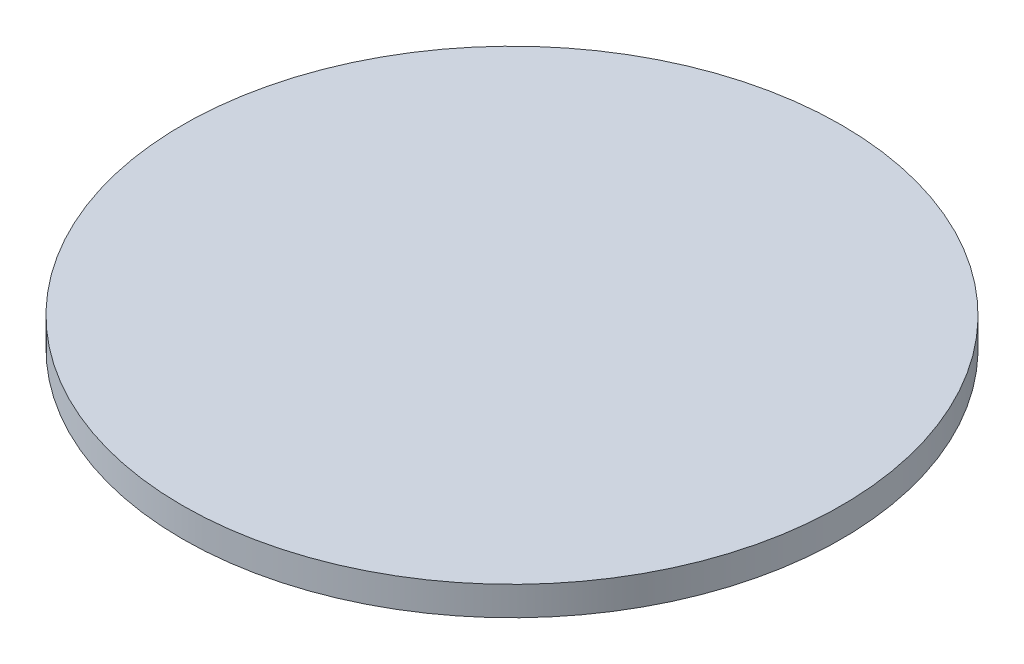
from build123d import *

# Parameters (mm, degrees)
SKETCH1_R           = 45.5
BOSS_EXTRUDE1_DEPTH = 4
SKETCH3_R           = 3
CUT_EXTRUDE1_DEPTH  = 3


with BuildPart() as part:
    # Sketch1 → Boss-Extrude1 (new body)
    with BuildSketch(Plane(origin=(0, 0, 0), x_dir=(1, 0, 0), z_dir=(0, 1, 0))):
        with Locations(Location((0, 0, 0), (0, 0, 270))):
            Circle(SKETCH1_R)
    extrude(amount=BOSS_EXTRUDE1_DEPTH)

    # Sketch3 → Cut-Extrude1 (cut)
    with BuildSketch(Plane.XZ):
        with Locations(Location((0, 25, 0), (0, 0, 270))):
            Circle(SKETCH3_R)
        with Locations(Location((25, 0, 0), (0, 0, 270))):
            Circle(SKETCH3_R)
        with Locations(Location((0, -25, 0), (0, 0, 270))):
            Circle(SKETCH3_R)
        with Locations(Location((-25, 0, 0), (0, 0, 270))):
            Circle(SKETCH3_R)
    extrude(amount=-CUT_EXTRUDE1_DEPTH, mode=Mode.SUBTRACT)


solid = part.part
